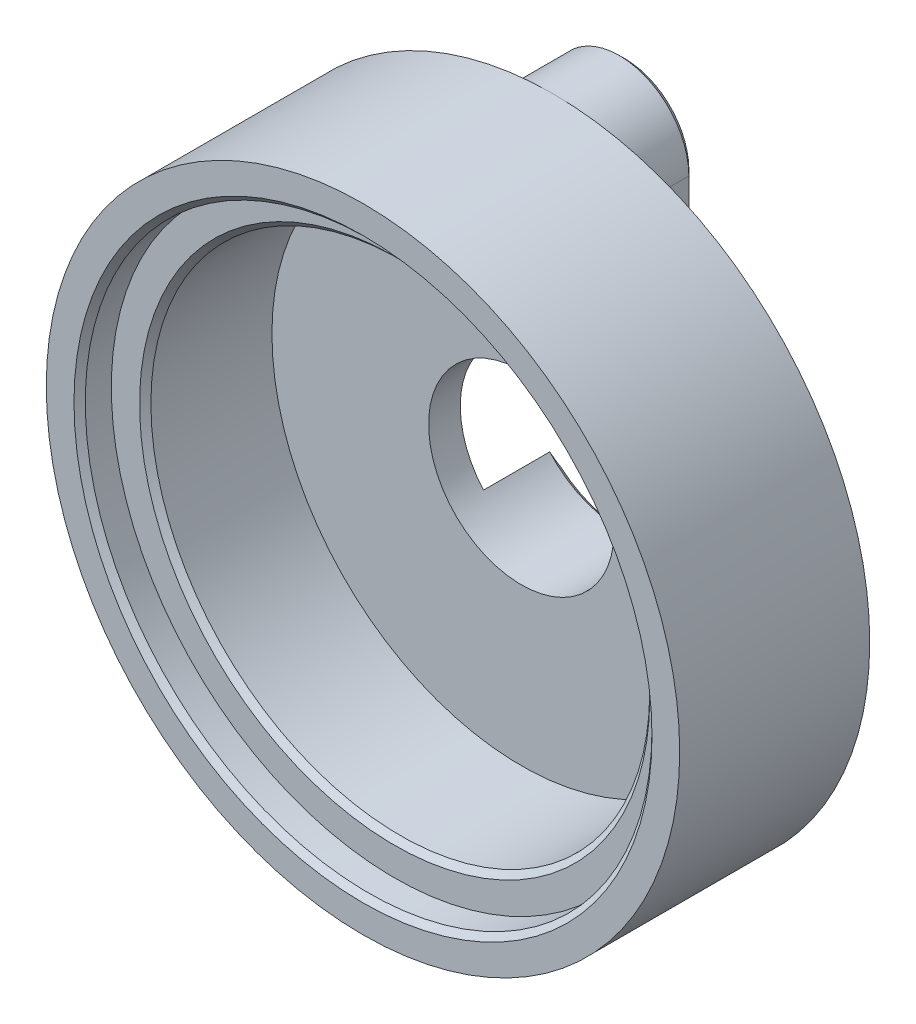
from build123d import *

# Parameters (mm, degrees)
BOSS_EXTRUDE1_DEPTH = 3.18
SKETCH2_R           = 14
BOSS_EXTRUDE2_DEPTH = 8.4
SKETCH3_R           = 4.1
CUT_EXTRUDE1_DEPTH  = 23.936791406
SKETCH4_R           = 11.025
CUT_EXTRUDE2_DEPTH  = 7
SKETCH5_R           = 12.525
CUT_EXTRUDE3_DEPTH  = 1.4
CHAMFER1_SIZE       = 0.25


with BuildPart() as part:
    # Sketch1 → Boss-Extrude1 (new body)
    with BuildSketch(Plane.XY):
        with BuildLine():
            Line((3.075, 10.925), (3.075, -10.925))
            ThreePointArc((3.075, -10.925), (0, -14), (-3.075, -10.925))
            Line((-3.075, -10.925), (-3.075, 10.925))
            ThreePointArc((-3.075, 10.925), (0, 14), (3.075, 10.925))
        make_face()
    extrude(amount=BOSS_EXTRUDE1_DEPTH)

    # Sketch2 → Boss-Extrude2 (add)
    with BuildSketch(Plane.XY.offset(3.18)):
        with Locations(Location((0, 0, 0), (0, 0, 270))):
            Circle(SKETCH2_R)
    extrude(amount=BOSS_EXTRUDE2_DEPTH)

    # Sketch3 → Cut-Extrude1 (cut, through all)
    with BuildSketch(Plane.XY.offset(11.58)):
        Circle(SKETCH3_R)
    extrude(amount=-CUT_EXTRUDE1_DEPTH, mode=Mode.SUBTRACT)

    # Sketch4 → Cut-Extrude2 (cut)
    with BuildSketch(Plane.XY.offset(11.58)):
        Circle(SKETCH4_R)
    extrude(amount=-CUT_EXTRUDE2_DEPTH, mode=Mode.SUBTRACT)

    # Sketch5 → Cut-Extrude3 (cut)
    with BuildSketch(Plane.XY.offset(11.58)):
        Circle(SKETCH5_R)
    extrude(amount=-CUT_EXTRUDE3_DEPTH, mode=Mode.SUBTRACT)

    # Chamfer1
    chamfer1_edges = [part.edges().sort_by_distance(p)[0] for p in [
        (3.075, 6.818447547, 0),
        (-3.075, -6.818447547, 0),
        (0, -4.1, 0),
        (0, 4.1, 0),
        (-12.525, 0, 11.58),
        (-11.025, 0, 10.18),
        (3.075, -6.818447547, 0),
        (0, -14, 0),
        (-3.075, 6.818447547, 0),
        (0, 14, 0),
    ]]
    chamfer(chamfer1_edges, length=CHAMFER1_SIZE)


solid = part.part
